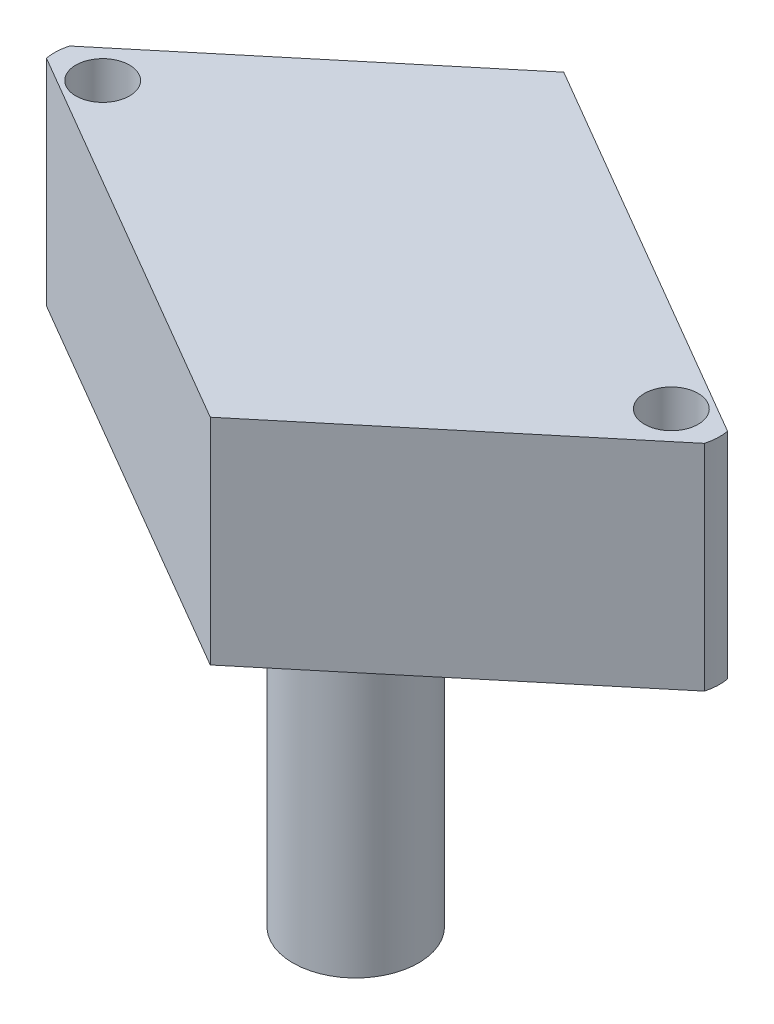
from build123d import *

# Parameters (mm, degrees)
SKETCH1_R           = 1.25
BOSS_EXTRUDE1_DEPTH = 10
SKETCH1_3_R         = 2.925
BOSS_EXTRUDE2_DEPTH = 20


with BuildPart() as part:
    # Sketch1 → Boss-Extrude1 (new body)
    with BuildSketch(Plane(origin=(0, 0, 0), x_dir=(1, 0, 0), z_dir=(0, 1, 0))):
        with BuildLine():
            Line((0.356274676, 9.337394122), (-12.211586722, -1.118308403))
            ThreePointArc((-12.211586722, -1.118308403), (-12.29724406, -1.631513563), (-12.262730232, -2.150672028))
            Line((-12.262730232, -2.150672028), (6.043725324, -12.823079133))
            Line((6.043725324, -12.823079133), (18.611586722, -2.367376608))
            ThreePointArc((18.611586722, -2.367376608), (18.69724406, -1.854171449), (18.662730232, -1.335012984))
            Line((18.662730232, -1.335012984), (0.356274676, 9.337394122))
        make_face()
        with Locations((-10.05, -1.742842506)):
            Circle(SKETCH1_R, mode=Mode.SUBTRACT)
        with Locations((16.45, -1.742842506)):
            Circle(SKETCH1_R, mode=Mode.SUBTRACT)
    extrude(amount=BOSS_EXTRUDE1_DEPTH)

    # Sketch1<3> → Boss-Extrude2 (add)
    with BuildSketch(Plane(origin=(0, 0, 0), x_dir=(1, 0, 0), z_dir=(0, 1, 0))):
        Circle(SKETCH1_3_R)
    extrude(amount=-BOSS_EXTRUDE2_DEPTH)


solid = part.part
